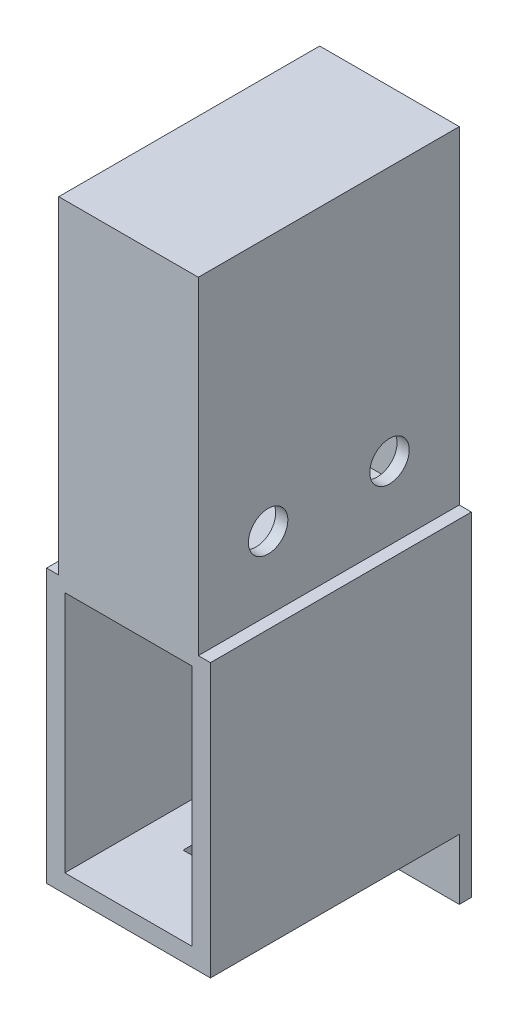
from build123d import *

# Parameters (mm, degrees)
SKETCH_1_W           = 23
SKETCH_1_H           = 43
EXTRUDE_1_DEPTH      = 54
SKETCH_2_OUTSIDE_W   = 39.552
SKETCH_2_OUTSIDE_H   = 59.552
SKETCH_2_OUTSIDE_W_2 = 23
SKETCH_2_OUTSIDE_H_2 = 43
SKETCH_2_OUTSIDE_W_3 = 19
SKETCH_2_OUTSIDE_H_3 = 39
CUT_EXTRUDE_1_DEPTH  = 44
SKETCH_3_W           = 27
SKETCH_3_H           = 45
SKETCH_3_W_2         = 21
SKETCH_3_H_2         = 40
EXTRUDE_2_DEPTH      = 43
SKETCH_4_R           = 3.25
CUT_EXTRUDE_2_DEPTH  = 74.416619372
SKETCH_5_W           = 8
SKETCH_5_H           = 3
CUT_EXTRUDE_3_DEPTH  = 30
SKETCH_6_R           = 2
EXTRUDE_3_DEPTH      = 2
EXTRUDE_4_DEPTH      = 10
EXTRUDE_4_DEPTH_BACK = 6
FILLET_1_R           = 2
EXTRUDE_5_DEPTH      = 30


with BuildPart() as part:
    # 草图1 → 凸台-拉伸1 (new body)
    with BuildSketch(Plane(origin=(0, 0, 0), x_dir=(1, 0, 0), z_dir=(0, 1, 0))):
        with Locations((11.5, 21.5)):
            Rectangle(SKETCH_1_W, SKETCH_1_H)
    extrude(amount=EXTRUDE_1_DEPTH)

    # 草图2 outside → 切除-拉伸1 (cut)
    # profile 1 of 2: a face of its own
    with BuildSketch(Plane.XZ):
        with Locations((11.5, -21.5)):
            Rectangle(SKETCH_2_OUTSIDE_W, SKETCH_2_OUTSIDE_H)
        with Locations((11.5, -21.5)):
            Rectangle(SKETCH_2_OUTSIDE_W_2, SKETCH_2_OUTSIDE_H_2, mode=Mode.SUBTRACT)
    # profile 2 of 2: a face of its own
    with BuildSketch(Plane.XZ):
        with Locations((11.5, -21.5)):
            Rectangle(SKETCH_2_OUTSIDE_W_3, SKETCH_2_OUTSIDE_H_3)
    extrude(amount=-CUT_EXTRUDE_1_DEPTH, mode=Mode.SUBTRACT)

    # 草图3 → 凸台-拉伸2 (add)
    with BuildSketch(Plane.XY):
        with Locations((11.5, -22.5)):
            Rectangle(SKETCH_3_W, SKETCH_3_H)
        with Locations((11.5, -22)):
            Rectangle(SKETCH_3_W_2, SKETCH_3_H_2, mode=Mode.SUBTRACT)
    extrude(amount=-EXTRUDE_2_DEPTH)

    # 草图4 → 切除-拉伸2 (cut, through all)
    with BuildSketch(Plane.ZY):
        with Locations((-31.5, 12)):
            Circle(SKETCH_4_R)
        with Locations((-11.5, 12)):
            Circle(SKETCH_4_R)
    extrude(amount=-CUT_EXTRUDE_2_DEPTH, mode=Mode.SUBTRACT)

    # 草图5 → 切除-拉伸3 (cut)
    with BuildSketch(Plane(origin=(0, 0, -43), x_dir=(-1, 0, 0), z_dir=(0, 0, -1))):
        with Locations((-11.5, -43.5)):
            Rectangle(SKETCH_5_W, SKETCH_5_H)
    extrude(amount=-CUT_EXTRUDE_3_DEPTH, mode=Mode.SUBTRACT)

    # 草图6 → 凸台-拉伸3 (add)
    with BuildSketch(Plane(origin=(0, 0, -43), x_dir=(-1, 0, 0), z_dir=(0, 0, -1))):
        Polygon((-25, -45), (-15.5, -45), (-15.5, -48), (-7.5, -48), (-7.5, -45), (2, -45), (2, -55), (-7.5, -55), (-15.5, -55), (-25, -55), align=None)
        with Locations((-16.5, -50)):
            Circle(SKETCH_6_R, mode=Mode.SUBTRACT)
        with Locations((-6.5, -50)):
            Circle(SKETCH_6_R, mode=Mode.SUBTRACT)
    extrude(amount=-EXTRUDE_3_DEPTH)

    # 草图8 → 凸台-拉伸4 (add, two sides: drawn at the far end of the back side and taken through both)
    with BuildSketch(Plane.XZ.offset(45).offset(-EXTRUDE_4_DEPTH_BACK)):
        Polygon((-8.6, -63.2), (-25.3, -63.2), (-25.3, -37), (-8.6, -37), (-2, -37), (-2, -43), (-8.6, -43), align=None)
        Polygon((-17.1, -59), (-23.3, -59), (-23.3, -59.7), (-21.2, -59.7), (-21.2, -60.5), (-23.3, -60.5), (-23.3, -62.2), (-19.6, -62.2), (-19.6, -61.1), (-18.8, -61.1), (-18.8, -62.2), (-10.6, -62.2), (-10.6, -59), (-16.3, -59), (-16.3, -60.1), (-17.1, -60.1), align=None, mode=Mode.SUBTRACT)
    extrude(amount=EXTRUDE_4_DEPTH + EXTRUDE_4_DEPTH_BACK)

    # 圆角1
    fillet_1_edges = [part.edges().sort_by_distance(p)[0] for p in [
        (15.5, -48, -42),
        (7.5, -48, -42),
    ]]
    fillet(fillet_1_edges, radius=FILLET_1_R)

    # 草图9 → 凸台-拉伸5 (add)
    with BuildSketch(Plane(origin=(0, -39, 0), x_dir=(1, 0, 0), z_dir=(0, 1, 0))):
        Polygon((-10.6, 57), (-10.6, 59), (-16.3, 59), (-16.3, 60.1), (-17.1, 60.1), (-17.1, 59), (-23.3, 59), (-23.3, 59.7), (-21.2, 59.7), (-21.2, 60.5), (-23.3, 60.5), (-23.3, 62.2), (-19.6, 62.2), (-19.6, 61.1), (-18.8, 61.1), (-18.8, 62.2), (-10.6, 62.2), (-10.6, 63.2), (-25.3, 63.2), (-25.3, 57), align=None)
    extrude(amount=EXTRUDE_5_DEPTH)


solid = part.part
